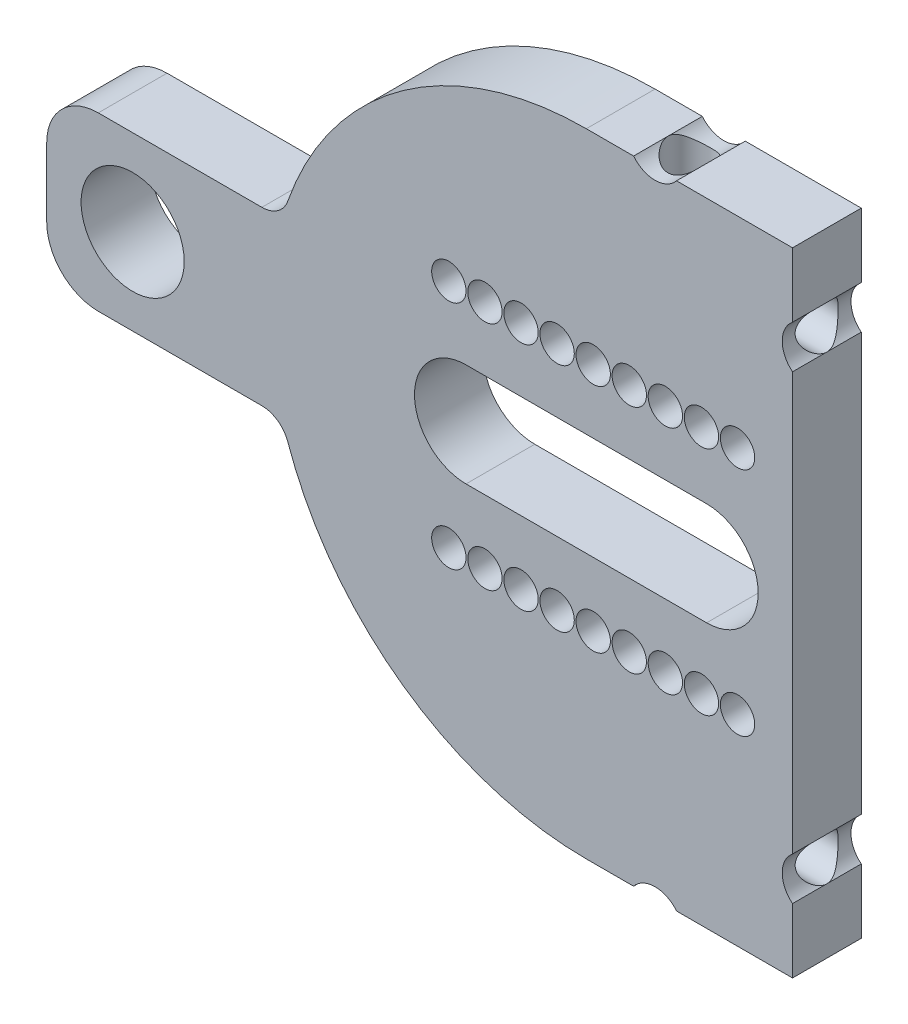
from build123d import *

# Parameters (mm, degrees)
CROQUIS1_R              = 1
SALIENTE_EXTRUIR1_DEPTH = 4
CROQUIS5_R              = 1.25
CORTAR_EXTRUIR2_DEPTH   = 6
SALIENTE_EXTRUIR2_START = -4
CROQUIS6_R              = 3
SALIENTE_EXTRUIR2_DEPTH = 4
CROQUIS8_R              = 1.25
CORTAR_EXTRUIR4_DEPTH   = 5
CORTAR_EXTRUIR5_START   = -31.8
CROQUIS8_2_R            = 1.25
CORTAR_EXTRUIR5_DEPTH   = 5
REDONDEO1_R             = 3
REDONDEO2_R             = 1.6
CROQUIS7_R              = 1.6
CORTAR_EXTRUIR3_DEPTH   = 4


with BuildPart() as part:
    # Croquis1 → Saliente-Extruir1 (new body)
    with BuildSketch(Plane.XY):
        with BuildLine():
            Line((12, 0), (12, 18.4))
            Line((12, 18.4), (0, 18.4))
            ThreePointArc((0, 18.4), (-18.4, 0), (0, -18.4))
            Line((0, -18.4), (12, -18.4))
            Line((12, -18.4), (12, 0))
        make_face()
        with Locations((-8, -6.72)):
            Circle(CROQUIS1_R, mode=Mode.SUBTRACT)
        with Locations((-8, 6.72)):
            Circle(CROQUIS1_R, mode=Mode.SUBTRACT)
        with Locations((-5.9, -6.72)):
            Circle(CROQUIS1_R, mode=Mode.SUBTRACT)
        with Locations((-5.9, 6.72)):
            Circle(CROQUIS1_R, mode=Mode.SUBTRACT)
        with Locations((-3.8, -6.72)):
            Circle(CROQUIS1_R, mode=Mode.SUBTRACT)
        with Locations((-3.8, 6.72)):
            Circle(CROQUIS1_R, mode=Mode.SUBTRACT)
        with Locations((-1.7, -6.72)):
            Circle(CROQUIS1_R, mode=Mode.SUBTRACT)
        with Locations((-1.7, 6.72)):
            Circle(CROQUIS1_R, mode=Mode.SUBTRACT)
        with Locations((0.4, -6.72)):
            Circle(CROQUIS1_R, mode=Mode.SUBTRACT)
        with Locations((0.4, 6.72)):
            Circle(CROQUIS1_R, mode=Mode.SUBTRACT)
        with Locations((2.5, -6.72)):
            Circle(CROQUIS1_R, mode=Mode.SUBTRACT)
        with Locations((2.5, 6.72)):
            Circle(CROQUIS1_R, mode=Mode.SUBTRACT)
        with Locations((4.6, -6.72)):
            Circle(CROQUIS1_R, mode=Mode.SUBTRACT)
        with Locations((4.6, 6.72)):
            Circle(CROQUIS1_R, mode=Mode.SUBTRACT)
        with Locations((6.7, -6.72)):
            Circle(CROQUIS1_R, mode=Mode.SUBTRACT)
        with Locations((6.7, 6.72)):
            Circle(CROQUIS1_R, mode=Mode.SUBTRACT)
        with Locations((8.8, -6.72)):
            Circle(CROQUIS1_R, mode=Mode.SUBTRACT)
        with Locations((8.8, 6.72)):
            Circle(CROQUIS1_R, mode=Mode.SUBTRACT)
        with BuildLine():
            Line((7, 3), (-7, 3))
            ThreePointArc((-7, 3), (-10, 0), (-7, -3))
            Line((-7, -3), (7, -3))
            ThreePointArc((7, -3), (10, 0), (7, 3))
        make_face(mode=Mode.SUBTRACT)
    extrude(amount=SALIENTE_EXTRUIR1_DEPTH)

    # Croquis5 → Cortar-Extruir2 (cut)
    with BuildSketch(Plane(origin=(12, 0, 0), x_dir=(0, 0, -1), z_dir=(1, 0, 0))):
        with Locations((-2, 13.4)):
            Circle(CROQUIS5_R)
        with Locations(Location((-2, -13.4, 0), (0, 0, 180))):
            Circle(CROQUIS5_R)
    extrude(amount=-CORTAR_EXTRUIR2_DEPTH, mode=Mode.SUBTRACT)

    # Croquis6 → Saliente-Extruir2 (add)
    with BuildSketch(Plane.XY.offset(4).offset(SALIENTE_EXTRUIR2_START)):
        with BuildLine():
            Line((-31.4, 5), (-31.4, -5))
            Line((-31.4, -5), (-17.707625476, -5))
            ThreePointArc((-17.707625476, -5), (-18.4, 0), (-17.707625476, 5))
            Line((-17.707625476, 5), (-31.4, 5))
        make_face()
        with Locations((-26.4, 0)):
            Circle(CROQUIS6_R, mode=Mode.SUBTRACT)
    extrude(amount=SALIENTE_EXTRUIR2_DEPTH)

    # Croquis8 → Cortar-Extruir4 (cut)
    with BuildSketch(Plane(origin=(0, 18.4, 0), x_dir=(1, 0, 0), z_dir=(0, 1, 0))):
        with Locations(Location((4, -2, 0), (0, 0, 270))):
            Circle(CROQUIS8_R)
    extrude(amount=-CORTAR_EXTRUIR4_DEPTH, mode=Mode.SUBTRACT)

    # Croquis8<2> → Cortar-Extruir5 (cut)
    with BuildSketch(Plane(origin=(0, 18.4, 0), x_dir=(1, 0, 0), z_dir=(0, 1, 0)).offset(CORTAR_EXTRUIR5_START)):
        with Locations(Location((4, -2, 0), (0, 0, 270))):
            Circle(CROQUIS8_2_R)
    extrude(amount=-CORTAR_EXTRUIR5_DEPTH, mode=Mode.SUBTRACT)

    # Redondeo1
    redondeo1_edges = [part.edges().sort_by_distance(p)[0] for p in [
        (-31.4, 5, 2),
        (-31.4, -5, 2),
    ]]
    fillet(redondeo1_edges, radius=REDONDEO1_R)

    # Redondeo2
    redondeo2_edges = [part.edges().sort_by_distance(p)[0] for p in [
        (-17.707625476, 5, 2),
        (-17.707625476, -5, 2),
    ]]
    fillet(redondeo2_edges, radius=REDONDEO2_R)

    # Croquis7 → Cortar-Extruir3 (cut)
    with BuildSketch(Plane.XY.offset(4)):
        with Locations((4, 19.4)):
            Circle(CROQUIS7_R)
        with Locations((4, -19.4)):
            Circle(CROQUIS7_R)
        with Locations((13, 13.4)):
            Circle(CROQUIS7_R)
        with Locations((13, -13.4)):
            Circle(CROQUIS7_R)
    extrude(amount=-CORTAR_EXTRUIR3_DEPTH, mode=Mode.SUBTRACT)


solid = part.part
